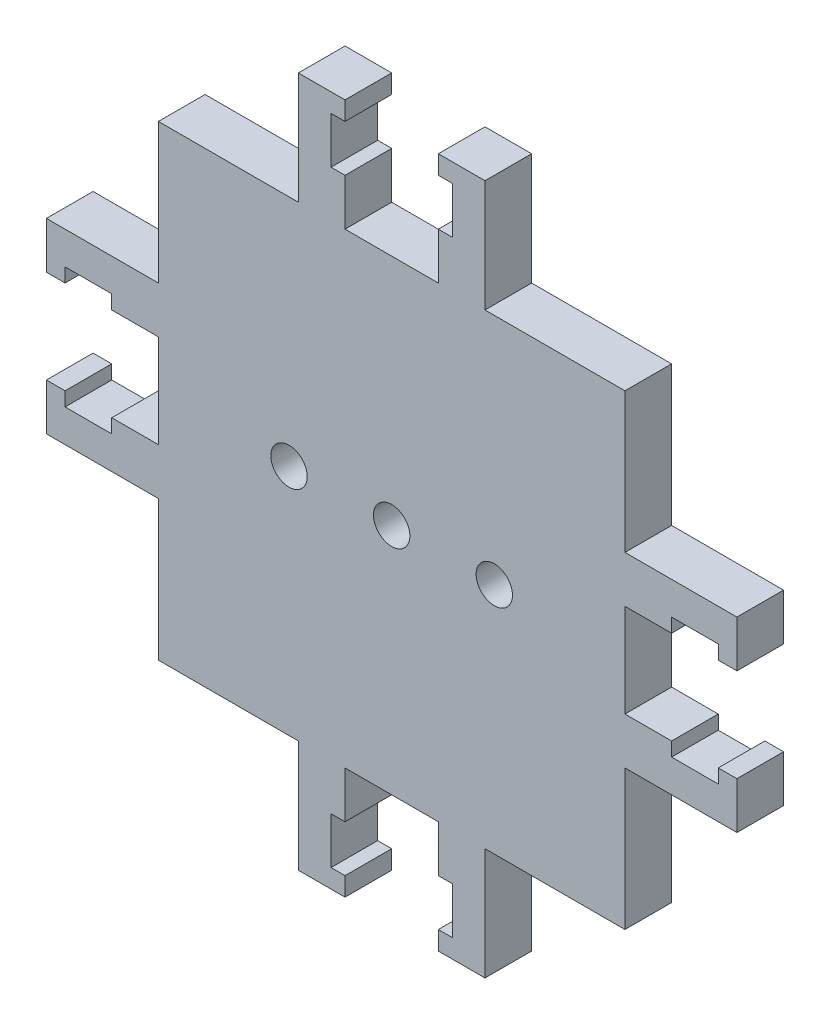
from build123d import *

# Parameters (mm, degrees)
ESQUISSE1_R        = 1.95
BOSS_EXTRU_1_DEPTH = 5


with BuildPart() as part:
    # Esquisse1 → Boss.-Extru.1 (new body)
    with BuildSketch(Plane.XY):
        Polygon((-10, 25), (-25, 25), (-25, 10), (-30, 10), (-37, 10), (-37, 5), (-35, 5), (-35, 6.5), (-30, 6.5), (-30, 5), (-25, 5), (-25, 0), (-25, -5), (-30, -5), (-30, -6.5), (-35, -6.5), (-35, -5), (-37, -5), (-37, -10), (-30, -10), (-25, -10), (-25, -25), (-10, -25), (-10, -30), (-10, -37), (-5, -37), (-5, -35), (-6.5, -35), (-6.5, -30), (-5, -30), (-5, -25), (0, -25), (5, -25), (5, -30), (6.5, -30), (6.5, -35), (5, -35), (5, -37), (10, -37), (10, -30), (10, -25), (25, -25), (25, -10), (30, -10), (37, -10), (37, -5), (35, -5), (35, -6.5), (30, -6.5), (30, -5), (25, -5), (25, 0), (25, 5), (30, 5), (30, 6.5), (35, 6.5), (35, 5), (37, 5), (37, 10), (30, 10), (25, 10), (25, 25), (10, 25), (10, 30), (10, 37), (5, 37), (5, 35), (6.5, 35), (6.5, 30), (5, 30), (5, 25), (0, 25), (-5, 25), (-5, 30), (-6.5, 30), (-6.5, 35), (-5, 35), (-5, 37), (-10, 37), (-10, 30), align=None)
        with Locations((-11, 0)):
            Circle(ESQUISSE1_R, mode=Mode.SUBTRACT)
        Circle(ESQUISSE1_R, mode=Mode.SUBTRACT)
        with Locations((11, 0)):
            Circle(ESQUISSE1_R, mode=Mode.SUBTRACT)
    extrude(amount=BOSS_EXTRU_1_DEPTH)


solid = part.part
